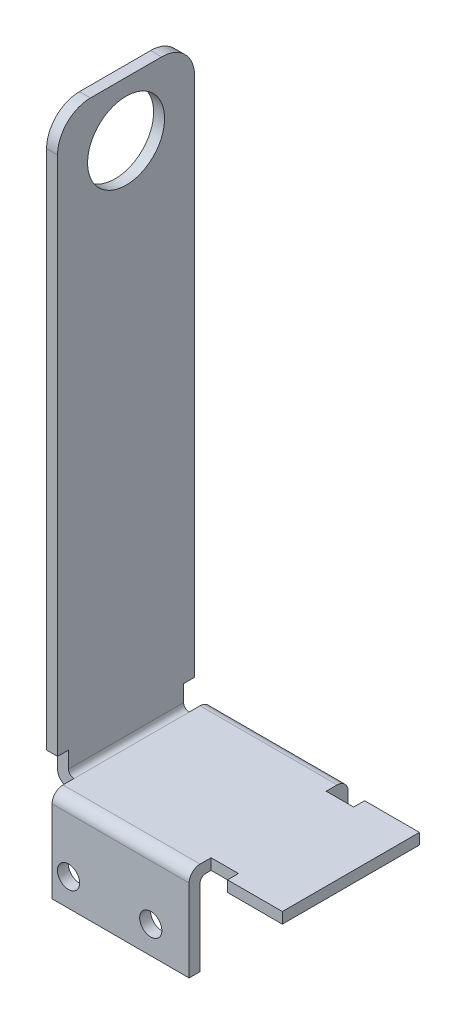
from build123d import *

# Parameters (mm, degrees)
SKETCH1_W                = 25
SKETCH1_H                = 25
BOSS_EXTRUDE1_DEPTH      = 2
BOSS_EXTRUDE2_DEPTH      = 15
BOSS_EXTRUDE2_DEPTH_BACK = 2
SKETCH2_W                = 25
SKETCH2_H                = 2
SKETCH3_R                = 2.025
CUT_EXTRUDE1_DEPTH       = 35.960692213
FILLET1_R                = 2
FILLET2_R                = 1
SKETCH4_W                = 21
SKETCH4_H                = 2
BOSS_EXTRUDE3_DEPTH      = 3
SKETCH5_W                = 21
SKETCH5_H                = 2
BOSS_EXTRUDE4_DEPTH      = 15
BOSS_EXTRUDE5_DEPTH      = 15
BOSS_EXTRUDE5_DEPTH_BACK = 36
SKETCH6_W                = 10
SKETCH6_H                = 2
SKETCH7_W                = 2
SKETCH7_H                = 41
BOSS_EXTRUDE6_DEPTH      = 105
SKETCH8_W                = 10
SKETCH8_H                = 4
CUT_EXTRUDE2_DEPTH       = 118.389309564
FILLET3_R                = 1
FILLET4_R                = 2
SKETCH12_R               = 7.025
CUT_EXTRUDE4_DEPTH       = 119.102709537
CUT_EXTRUDE5_DEPTH       = 119.102709537
FILLET7_R                = 6
FILLET8_R                = 6
SKETCH14_W               = 10
SKETCH14_H               = 5
CUT_EXTRUDE6_DEPTH       = 112.496636721
SKETCH15_W               = 15
SKETCH15_H               = 54
CUT_EXTRUDE7_DEPTH       = 117.405541105
SKETCH16_W               = 10
SKETCH16_H               = 8
CUT_EXTRUDE8_DEPTH       = 10


with BuildPart() as part:
    # Sketch1 → Boss-Extrude1 (new body)
    with BuildSketch(Plane(origin=(0, 0, 0), x_dir=(1, 0, 0), z_dir=(0, 1, 0))):
        Rectangle(SKETCH1_W, SKETCH1_H)
    extrude(amount=BOSS_EXTRUDE1_DEPTH)

    # Sketch2 → Boss-Extrude2 (add, two sides: drawn at the far end of the back side and taken through both)
    with BuildSketch(Plane.XZ.offset(-BOSS_EXTRUDE2_DEPTH_BACK)):
        with Locations((0, 13.5)):
            Rectangle(SKETCH2_W, SKETCH2_H)
        with Locations((0, -13.5)):
            Rectangle(SKETCH2_W, SKETCH2_H)
    extrude(amount=BOSS_EXTRUDE2_DEPTH + BOSS_EXTRUDE2_DEPTH_BACK)

    # Sketch3 → Cut-Extrude1 (cut, through all)
    with BuildSketch(Plane.XY.offset(14.5)):
        with Locations((-9.5, -10)):
            Circle(SKETCH3_R)
        with Locations((5.5, -10)):
            Circle(SKETCH3_R)
    extrude(amount=-CUT_EXTRUDE1_DEPTH, mode=Mode.SUBTRACT)

    # Fillet1
    fillet1_edges = [part.edges().sort_by_distance(p)[0] for p in [
        (0, 2, 14.5),
        (0, 2, -14.5),
    ]]
    fillet(fillet1_edges, radius=FILLET1_R)

    # Fillet2
    fillet2_edges = [part.edges().sort_by_distance(p)[0] for p in [
        (0, 0, 12.5),
        (0, 0, -12.5),
    ]]
    fillet(fillet2_edges, radius=FILLET2_R)

    # Sketch4 → Boss-Extrude3 (add)
    with BuildSketch(Plane.ZY.offset(12.5)):
        with Locations((0, 1)):
            Rectangle(SKETCH4_W, SKETCH4_H)
    extrude(amount=BOSS_EXTRUDE3_DEPTH)

    # Sketch5 → Boss-Extrude4 (add)
    with BuildSketch(Plane(origin=(12.5, 0, 0), x_dir=(0, 0, -1), z_dir=(1, 0, 0))):
        with Locations((0, 1)):
            Rectangle(SKETCH5_W, SKETCH5_H)
    extrude(amount=BOSS_EXTRUDE4_DEPTH)

    # Sketch6 → Boss-Extrude5 (add, two sides: drawn at the far end of the back side and taken through both)
    with BuildSketch(Plane.XY.offset(10.5).offset(-BOSS_EXTRUDE5_DEPTH_BACK)):
        with Locations((22.5, 1)):
            Rectangle(SKETCH6_W, SKETCH6_H)
    extrude(amount=BOSS_EXTRUDE5_DEPTH + BOSS_EXTRUDE5_DEPTH_BACK)

    # Sketch7 → Boss-Extrude6 (add)
    with BuildSketch(Plane(origin=(0, 2, 0), x_dir=(1, 0, 0), z_dir=(0, 1, 0))):
        with Locations((-14.5, 0)):
            Rectangle(SKETCH7_W, SKETCH7_H)
    extrude(amount=BOSS_EXTRUDE6_DEPTH)

    # Sketch8 → Cut-Extrude2 (cut, through all)
    with BuildSketch(Plane(origin=(-13.5, 0, 0), x_dir=(0, 0, -1), z_dir=(1, 0, 0))):
        with Locations((-15.5, 4)):
            Rectangle(SKETCH8_W, SKETCH8_H)
        with Locations((15.5, 4)):
            Rectangle(SKETCH8_W, SKETCH8_H)
    extrude(amount=-CUT_EXTRUDE2_DEPTH, mode=Mode.SUBTRACT)

    # Fillet3
    fillet3_edges = [part.edges().sort_by_distance(p)[0] for p in [
        (-13.5, 2, 0),
    ]]
    fillet(fillet3_edges, radius=FILLET3_R)

    # Fillet4
    fillet4_edges = [part.edges().sort_by_distance(p)[0] for p in [
        (-15.5, 0, 0),
    ]]
    fillet(fillet4_edges, radius=FILLET4_R)

    # Sketch12 → Cut-Extrude4 (cut, through all)
    with BuildSketch(Plane.ZY.offset(15.5)):
        with Locations((0, 97)):
            Circle(SKETCH12_R)
    extrude(amount=-CUT_EXTRUDE4_DEPTH, mode=Mode.SUBTRACT)

    # Sketch13 → Cut-Extrude5 (cut, through all)
    with BuildSketch(Plane.ZY.offset(15.5)):
        Polygon((-20.5, 107), (-20.5, 52), (-12.5, 60), (-12.5, 107), align=None)
        Polygon((12.5, 60), (12.5, 107), (20.5, 107), (20.5, 52), align=None)
    extrude(amount=-CUT_EXTRUDE5_DEPTH, mode=Mode.SUBTRACT)

    # Fillet7
    fillet7_edges = [part.edges().sort_by_distance(p)[0] for p in [
        (-14.5, 107, 12.5),
        (-14.5, 107, -12.5),
    ]]
    fillet(fillet7_edges, radius=FILLET7_R)

    # Fillet8
    fillet8_edges = [part.edges().sort_by_distance(p)[0] for p in [
        (-14.5, 6, 20.5),
        (-14.5, 6, -20.5),
    ]]
    fillet(fillet8_edges, radius=FILLET8_R)

    # Sketch14 → Cut-Extrude6 (cut, through all)
    with BuildSketch(Plane(origin=(0, 2, 0), x_dir=(1, 0, 0), z_dir=(0, 1, 0))):
        with Locations((22.5, 23)):
            Rectangle(SKETCH14_W, SKETCH14_H)
        with Locations((22.5, -23)):
            Rectangle(SKETCH14_W, SKETCH14_H)
    extrude(amount=-CUT_EXTRUDE6_DEPTH, mode=Mode.SUBTRACT)

    # Sketch15 → Cut-Extrude7 (cut, through all)
    with BuildSketch(Plane(origin=(-13.5, 0, 0), x_dir=(0, 0, -1), z_dir=(1, 0, 0))):
        with Locations((-20, 33)):
            Rectangle(SKETCH15_W, SKETCH15_H)
        with Locations((20, 33)):
            Rectangle(SKETCH15_W, SKETCH15_H)
    extrude(amount=-CUT_EXTRUDE7_DEPTH, mode=Mode.SUBTRACT)

    # Sketch16 → Cut-Extrude8 (cut)
    with BuildSketch(Plane(origin=(0, 2, 0), x_dir=(1, 0, 0), z_dir=(0, 1, 0))):
        with Locations((22.5, -16.5)):
            Rectangle(SKETCH16_W, SKETCH16_H)
        with Locations((22.5, 16.5)):
            Rectangle(SKETCH16_W, SKETCH16_H)
    extrude(amount=-CUT_EXTRUDE8_DEPTH, mode=Mode.SUBTRACT)


solid = part.part
